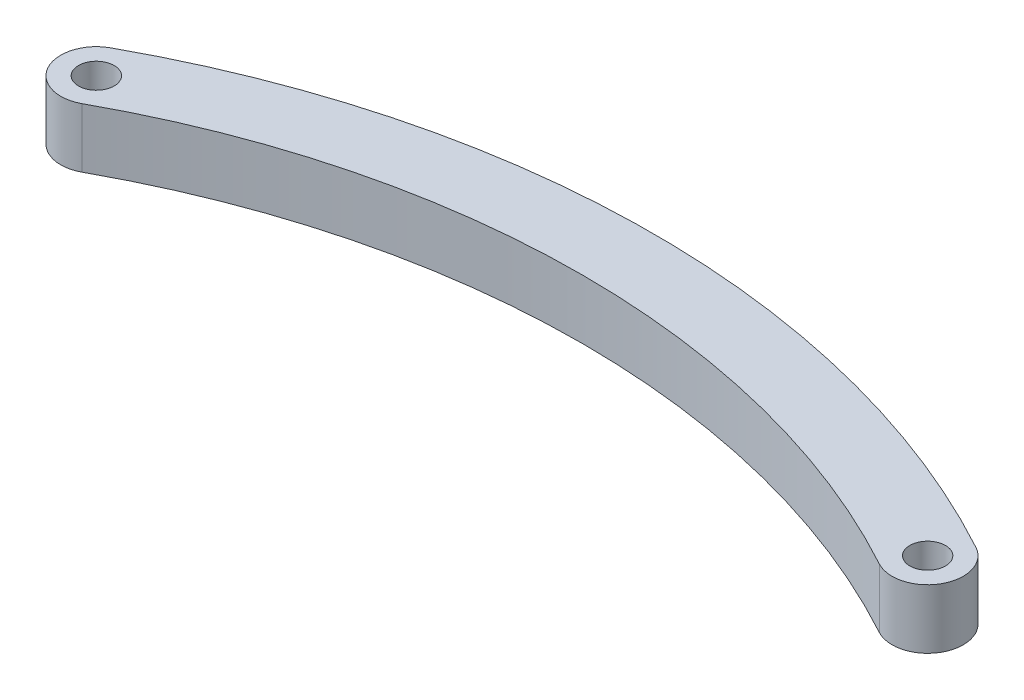
from build123d import *

# Parameters (mm, degrees)
ESQUISSE1_R        = 1.5
BOSS_EXTRU_1_DEPTH = 5


with BuildPart() as part:
    # Esquisse1 → Boss.-Extru.1 (new body)
    with BuildSketch(Plane(origin=(0, 0, 0), x_dir=(1, 0, 0), z_dir=(0, 1, 0))):
        with BuildLine():
            ThreePointArc((-36.438356038, 2.632704296), (-37.632704242, -1.438356135), (-33.561643767, -2.632704189))
            ThreePointArc((-33.561643767, -2.632704189), (6.8e-08, 5.937530488), (33.561643886, -2.632704254))
            ThreePointArc((33.561643886, -2.632704254), (37.632704286, -1.438356055), (36.438355996, 2.632704318))
            ThreePointArc((36.438355996, 2.632704318), (-2.4e-08, 11.937530488), (-36.438356038, 2.632704296))
        make_face()
        with Locations(Location((-35, 0, 0), (0, 0, 270))):
            Circle(ESQUISSE1_R, mode=Mode.SUBTRACT)
        with Locations(Location((35, 0, 0), (0, 0, 270))):
            Circle(ESQUISSE1_R, mode=Mode.SUBTRACT)
    extrude(amount=BOSS_EXTRU_1_DEPTH)


solid = part.part
